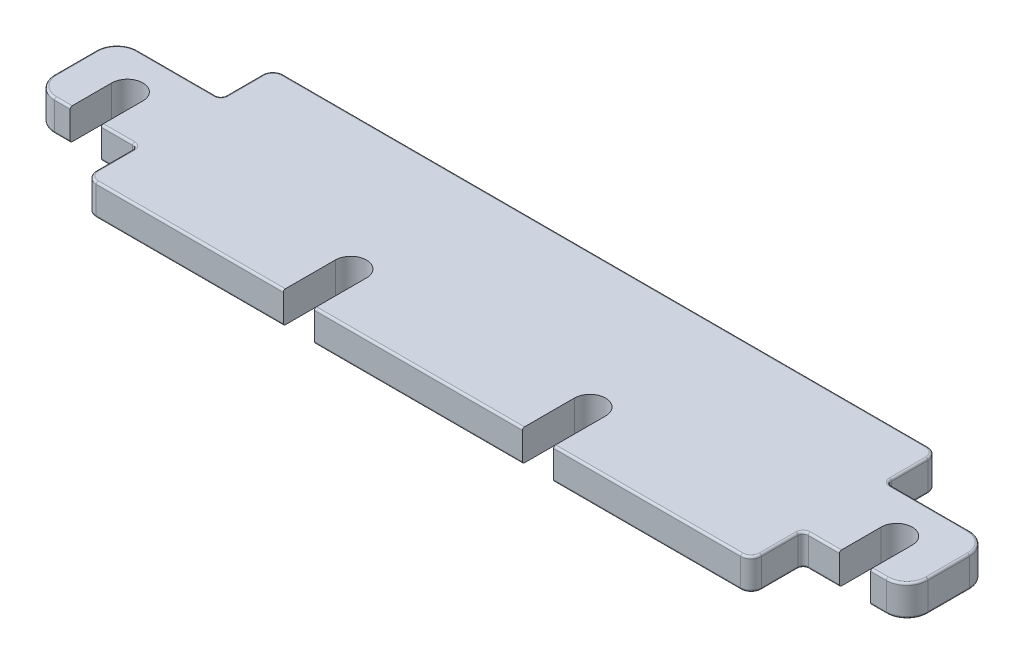
from build123d import *

# Parameters (mm, degrees)
BOSS_EXTRUDE1_DEPTH = 3
FILLET1_R           = 0.2


with BuildPart() as part:
    # Sketch1 → Boss-Extrude1 (new body)
    with BuildSketch(Plane(origin=(0, 0, 0), x_dir=(1, 0, 0), z_dir=(0, 1, 0))):
        with BuildLine():
            Line((-10, 5), (-10, 0))
            Line((-10, 0), (10, 0))
            Line((10, 0), (10, 5))
            ThreePointArc((10, 5), (11.5, 6.5), (13, 5))
            Line((13, 5), (13, 0))
            Line((13, 0), (31, 0))
            ThreePointArc((31, 0), (31.707106781, 0.292893219), (32, 1))
            Line((32, 1), (32, 4.5))
            ThreePointArc((32, 4.5), (32.146446609, 4.853553391), (32.5, 5))
            Line((32.5, 5), (35.5, 5))
            Line((35.5, 5), (35.5, 9))
            ThreePointArc((35.5, 9), (37, 10.5), (38.5, 9))
            Line((38.5, 9), (38.5, 5))
            Line((38.5, 5), (40, 5))
            ThreePointArc((40, 5), (41.414213562, 5.585786438), (42, 7))
            Line((42, 7), (42, 11))
            ThreePointArc((42, 11), (41.414213562, 12.414213562), (40, 13))
            Line((40, 13), (32.5, 13))
            ThreePointArc((32.5, 13), (32.146446609, 13.146446609), (32, 13.5))
            Line((32, 13.5), (32, 17))
            ThreePointArc((32, 17), (31.707106781, 17.707106781), (31, 18))
            Line((31, 18), (-31, 18))
            ThreePointArc((-31, 18), (-31.707106781, 17.707106781), (-32, 17))
            Line((-32, 17), (-32, 13.5))
            ThreePointArc((-32, 13.5), (-32.146446609, 13.146446609), (-32.5, 13))
            Line((-32.5, 13), (-40, 13))
            ThreePointArc((-40, 13), (-41.414213562, 12.414213562), (-42, 11))
            Line((-42, 11), (-42, 7))
            ThreePointArc((-42, 7), (-41.414213562, 5.585786438), (-40, 5))
            Line((-40, 5), (-38.5, 5))
            Line((-38.5, 5), (-38.5, 9))
            ThreePointArc((-38.5, 9), (-37, 10.5), (-35.5, 9))
            Line((-35.5, 9), (-35.5, 5))
            Line((-35.5, 5), (-32.5, 5))
            ThreePointArc((-32.5, 5), (-32.146446609, 4.853553391), (-32, 4.5))
            Line((-32, 4.5), (-32, 1))
            ThreePointArc((-32, 1), (-31.707106781, 0.292893219), (-31, 0))
            Line((-31, 0), (-13, 0))
            Line((-13, 0), (-13, 5))
            ThreePointArc((-13, 5), (-11.5, 6.5), (-10, 5))
        make_face()
    extrude(amount=BOSS_EXTRUDE1_DEPTH)

    # Fillet1
    fillet1_edges = [part.edges().sort_by_distance(p)[0] for p in [
        (0, 3, 0),
        (-34, 3, -5),
        (-32.146446609, 3, -4.853553391),
        (-32, 3, -2.75),
        (-31.707106781, 3, -0.292893219),
        (-22, 3, 0),
        (22, 3, 0),
        (31.707106781, 3, -0.292893219),
        (32, 3, -2.75),
        (32.146446609, 3, -4.853553391),
        (-22, 0, 0),
        (34, 3, -5),
        (-31.707106781, 0, -0.292893219),
        (-32, 0, -2.75),
        (-32.146446609, 0, -4.853553391),
        (-34, 0, -5),
        (-39.25, 0, -5),
        (-41.414213562, 0, -5.585786438),
        (-42, 0, -9),
        (-41.414213562, 0, -12.414213562),
        (-36.25, 0, -13),
        (-32.146446609, 0, -13.146446609),
        (-32, 0, -15.25),
        (-31.707106781, 0, -17.707106781),
        (0, 0, -18),
        (31.707106781, 0, -17.707106781),
        (32, 0, -15.25),
        (32.146446609, 0, -13.146446609),
        (36.25, 0, -13),
        (41.414213562, 0, -12.414213562),
        (42, 0, -9),
        (41.414213562, 0, -5.585786438),
        (39.25, 0, -5),
        (34, 0, -5),
        (32.146446609, 0, -4.853553391),
        (32, 0, -2.75),
        (39.25, 3, -5),
        (31.707106781, 0, -0.292893219),
        (22, 0, 0),
        (0, 0, 0),
        (41.414213562, 3, -5.585786438),
        (42, 3, -9),
        (41.414213562, 3, -12.414213562),
        (36.25, 3, -13),
        (32.146446609, 3, -13.146446609),
        (32, 3, -15.25),
        (31.707106781, 3, -17.707106781),
        (0, 3, -18),
        (-31.707106781, 3, -17.707106781),
        (-32, 3, -15.25),
        (-32.146446609, 3, -13.146446609),
        (-36.25, 3, -13),
        (-41.414213562, 3, -12.414213562),
        (-42, 3, -9),
        (-41.414213562, 3, -5.585786438),
        (-39.25, 3, -5),
    ]]
    fillet(fillet1_edges, radius=FILLET1_R)


solid = part.part
